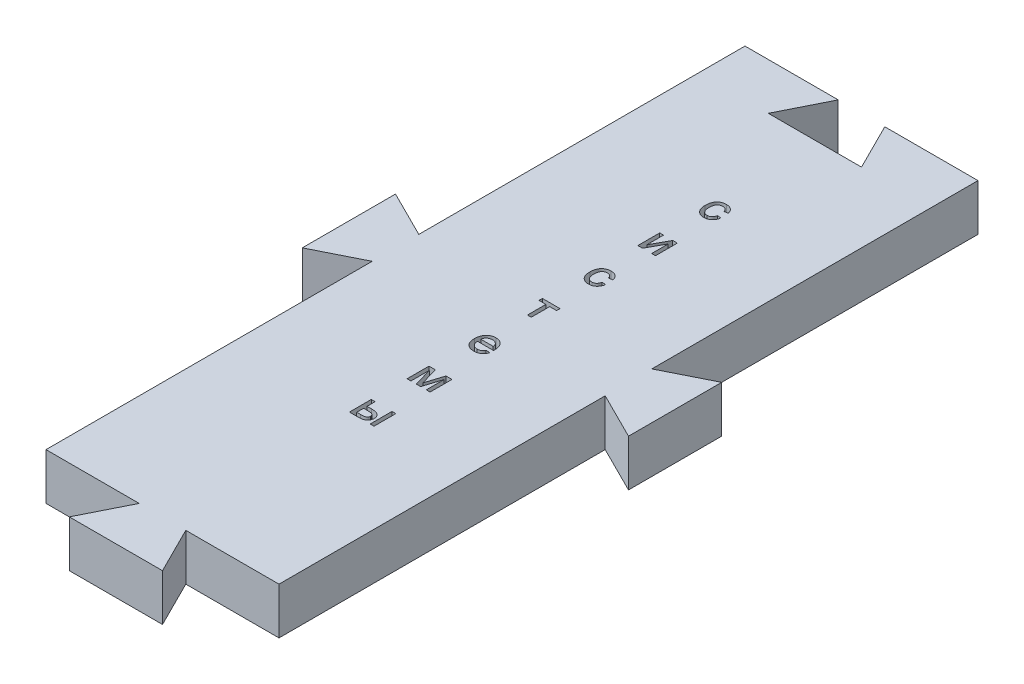
from build123d import *

# Parameters (mm, degrees)
EXTRUDE_1_DEPTH     = 4
SKETCH_2_W          = 0.329271627
SKETCH_2_H          = 1.87684827
CUT_EXTRUDE_2_DEPTH = 45.924937396


with BuildPart() as part:
    # Эскиз1 → Бобышка-Вытянуть1 (new body)
    with BuildSketch(Plane(origin=(0, 0, 0), x_dir=(1, 0, 0), z_dir=(0, 1, 0))):
        Polygon((10, 42.5), (2, 42.5), (4, 38.5), (-4, 38.5), (-2, 42.5), (-10, 42.5), (-10, 14.5), (-14, 16.5), (-14, 8.5), (-10, 10.5), (-10, -17.5), (-2, -17.5), (-4, -21.5), (4, -21.5), (2, -17.5), (10, -17.5), (10, 10.5), (14, 8.5), (14, 16.5), (10, 14.5), align=None)
    extrude(amount=EXTRUDE_1_DEPTH)

    # Эскиз2 → Вырез-Вытянуть2 (cut, through all)
    # profile 1 of 8: a face of its own
    with BuildSketch(Plane(origin=(0, 0, 0), x_dir=(1, 0, 0), z_dir=(0, 1, 0))):
        with BuildLine():
            Line((1.415867993, 28.713348785), (1.745139619, 28.680421622))
            add(Edge.make_bspline(
                [(1.745139619, 28.680421622), (1.740582778, 28.654094932), (1.731632112, 28.60238336), (1.711309306, 28.527574364), (1.686316374, 28.457155782), (1.656134219, 28.391082987), (1.62142165, 28.329466239), (1.581397849, 28.272297465), (1.536410623, 28.219612381), (1.486861536, 28.171457776), (1.433005447, 28.128792998), (1.376523853, 28.090851034), (1.316485548, 28.059592042), (1.253868642, 28.033588872), (1.18820581, 28.013567965), (1.119546334, 27.999034881), (1.047859948, 27.990953021), (0.999152606, 27.989625035), (0.974438219, 27.988951207)],
                knots=[0, 0, 0, 0, 1.126290047, 2.212288299, 3.264625211, 4.274421374, 5.27199577, 6.243132084, 7.212758999, 8.189695438, 9.152066023, 10.106906036, 11.054818061, 12.001736236, 12.962610873, 13.945632539, 14.95760209, 16, 16, 16, 16], degree=3))
            add(Edge.make_bspline(
                [(0.974438219, 27.988951207), (0.943538412, 27.989812439), (0.88290093, 27.991502511), (0.794246709, 28.00266522), (0.710328713, 28.02233905), (0.631160631, 28.049677316), (0.556420513, 28.084700432), (0.486879906, 28.128375805), (0.421375303, 28.179032096), (0.361332523, 28.237721141), (0.307080407, 28.303643158), (0.260216716, 28.376877937), (0.219755411, 28.456330223), (0.187534955, 28.542911359), (0.162348446, 28.635926492), (0.144553696, 28.735770211), (0.133647665, 28.842241661), (0.132366039, 28.915515244), (0.131708651, 28.953099688)],
                knots=[0, 0, 0, 0, 1.023197875, 2.007913629, 2.952854009, 3.872368111, 4.776711232, 5.679644676, 6.586124885, 7.513792122, 8.45395957, 9.406953999, 10.38727148, 11.400874437, 12.46026104, 13.574150989, 14.755701814, 16, 16, 16, 16], degree=3))
            add(Edge.make_bspline(
                [(0.131708651, 28.953099688), (0.131997583, 28.97780251), (0.132567942, 29.02656632), (0.137307257, 29.098497779), (0.144910749, 29.168046247), (0.155817073, 29.235165532), (0.169399327, 29.300039711), (0.187185655, 29.362227009), (0.207170271, 29.422251189), (0.230181201, 29.47971935), (0.256392956, 29.534519033), (0.286041625, 29.585868894), (0.319372948, 29.633473652), (0.355268299, 29.678035366), (0.395068638, 29.718645052), (0.437889116, 29.755839622), (0.483838439, 29.789415069), (0.549050471, 29.828937037), (0.635266323, 29.869992174), (0.744102706, 29.905814506), (0.857649884, 29.92747965), (0.934901181, 29.930252919), (0.973923732, 29.931653802)],
                knots=[0, 0, 0, 0, 1.013805669, 2.001270362, 2.957354649, 3.884259307, 4.791280502, 5.67595866, 6.537369654, 7.386966453, 8.214944774, 9.028648359, 9.817495426, 10.598008034, 11.374511297, 12.14791384, 12.923651068, 13.707109795, 15.274991334, 16.830882343, 18.399158828, 20, 20, 20, 20], degree=3))
            add(Edge.make_bspline(
                [(0.973923732, 29.931653802), (0.998465697, 29.931139599), (1.046627906, 29.930130504), (1.116958271, 29.922833743), (1.184097536, 29.911089985), (1.24760722, 29.894196305), (1.307949111, 29.872518553), (1.364564022, 29.845696306), (1.417831374, 29.81423851), (1.467415763, 29.778024836), (1.513270616, 29.737546359), (1.554404631, 29.692405319), (1.591986313, 29.643766278), (1.624577988, 29.590605721), (1.653917721, 29.53372663), (1.677577655, 29.472316994), (1.698180887, 29.407303756), (1.707472915, 29.362048176), (1.712212457, 29.338964875)],
                knots=[0, 0, 0, 0, 1.132709169, 2.22287732, 3.260172152, 4.27594812, 5.252565374, 6.215743486, 7.163376455, 8.103906971, 9.045968701, 9.981589193, 10.918916077, 11.878868217, 12.855998669, 13.868839979, 14.912969196, 16, 16, 16, 16], degree=3))
            Line((1.712212457, 29.338964875), (1.38294083, 29.306037712))
            add(Edge.make_bspline(
                [(1.38294083, 29.306037712), (1.375305492, 29.332039723), (1.3607024, 29.381770299), (1.32724784, 29.449584197), (1.28531, 29.506934959), (1.235300826, 29.553930157), (1.178376594, 29.590181305), (1.116074399, 29.616780626), (1.047760103, 29.632612436), (1.000419112, 29.63439116), (0.97598168, 29.635309339)],
                knots=[0, 0, 0, 0, 1.141726713, 2.183628378, 3.172002178, 4.124091198, 5.061356818, 6.004746239, 6.970049491, 8, 8, 8, 8], degree=3))
            add(Edge.make_bspline(
                [(0.97598168, 29.635309339), (0.957255736, 29.634860726), (0.920666759, 29.633984172), (0.867317766, 29.625793751), (0.816399262, 29.613878688), (0.768473615, 29.595448224), (0.722794164, 29.572837295), (0.679892342, 29.544962093), (0.640064158, 29.511592607), (0.602901794, 29.47354085), (0.569088151, 29.429913111), (0.539693904, 29.380411173), (0.515749064, 29.32471313), (0.495653421, 29.26359085), (0.479744283, 29.196485819), (0.468716676, 29.123355988), (0.461942018, 29.044464392), (0.461307844, 28.98998566), (0.460980277, 28.961845965)],
                knots=[0, 0, 0, 0, 0.934506579, 1.825950114, 2.690068634, 3.541100821, 4.383731181, 5.231784627, 6.089299408, 6.973555431, 7.883203127, 8.839396139, 9.840301414, 10.904673265, 12.049269491, 13.27993044, 14.595012659, 16, 16, 16, 16], degree=3))
            add(Edge.make_bspline(
                [(0.460980277, 28.961845965), (0.461284046, 28.933189236), (0.461868852, 28.878020157), (0.468876223, 28.798329892), (0.479214202, 28.724479131), (0.494793561, 28.656817596), (0.513405127, 28.594657934), (0.537738977, 28.539072406), (0.565940647, 28.489187627), (0.598657779, 28.445635557), (0.634903898, 28.407774892), (0.674276161, 28.375506783), (0.715611188, 28.347110995), (0.760131252, 28.324548603), (0.807233957, 28.30687068), (0.857003168, 28.294766162), (0.909177104, 28.286657428), (0.944909325, 28.28575538), (0.963119507, 28.285295671)],
                knots=[0, 0, 0, 0, 1.439417322, 2.771123253, 4.016540659, 5.182963063, 6.256782941, 7.271700823, 8.22505475, 9.129818122, 10.001307906, 10.851929949, 11.68361798, 12.516019905, 13.353091662, 14.205762507, 15.085604268, 16, 16, 16, 16], degree=3))
            add(Edge.make_bspline(
                [(0.963119507, 28.285295671), (0.977714164, 28.285533981), (1.006483856, 28.28600375), (1.048782225, 28.291466686), (1.089255458, 28.299477912), (1.127907023, 28.310848982), (1.164479288, 28.32595169), (1.199491674, 28.343893338), (1.232763434, 28.365022969), (1.263500211, 28.389991357), (1.292836943, 28.417583076), (1.318236174, 28.449885891), (1.341685871, 28.485047677), (1.362175776, 28.52389157), (1.380338948, 28.566137024), (1.394878811, 28.612082573), (1.407674912, 28.66129028), (1.413078485, 28.695624361), (1.415867993, 28.713348785)],
                knots=[0, 0, 0, 0, 1.014969467, 2.000756802, 2.962635172, 3.883905016, 4.799126561, 5.711777145, 6.618793064, 7.535724579, 8.464077664, 9.414562763, 10.387627853, 11.401965749, 12.465912699, 13.582944017, 14.752233276, 16, 16, 16, 16], degree=3))
        make_face()
    # profile 2 of 8: a face of its own
    with BuildSketch(Plane(origin=(0, 0, 0), x_dir=(1, 0, 0), z_dir=(0, 1, 0))):
        Polygon((0.230490138, 24.947467124), (0.559761765, 24.947467124), (0.559761765, 23.516164524), (1.34795572, 24.947467124), (1.745139619, 24.947467124), (1.745139619, 23.070618855), (1.415867993, 23.070618855), (1.415867993, 24.493175177), (0.632818907, 23.070618855), (0.230490138, 23.070618855), align=None)
    # profile 3 of 8: a face of its own
    with BuildSketch(Plane(origin=(0, 0, 0), x_dir=(1, 0, 0), z_dir=(0, 1, 0))):
        with BuildLine():
            Line((1.415867993, 18.810829755), (1.745139619, 18.777902592))
            add(Edge.make_bspline(
                [(1.745139619, 18.777902592), (1.740582778, 18.751575902), (1.731632112, 18.69986433), (1.711309306, 18.625055334), (1.686316374, 18.554636752), (1.656134219, 18.488563957), (1.62142165, 18.426947209), (1.581397849, 18.369778434), (1.536410623, 18.317093351), (1.486861536, 18.268938746), (1.433005447, 18.226273968), (1.376523853, 18.188332004), (1.316485548, 18.157073011), (1.253868642, 18.131069841), (1.18820581, 18.111048935), (1.119546334, 18.09651585), (1.047859948, 18.08843399), (0.999152606, 18.087106004), (0.974438219, 18.086432177)],
                knots=[0, 0, 0, 0, 1.126290047, 2.212288299, 3.264625211, 4.274421374, 5.27199577, 6.243132084, 7.212758999, 8.189695438, 9.152066023, 10.106906036, 11.054818061, 12.001736236, 12.962610873, 13.945632539, 14.95760209, 16, 16, 16, 16], degree=3))
            add(Edge.make_bspline(
                [(0.974438219, 18.086432177), (0.943538412, 18.087293408), (0.88290093, 18.088983481), (0.794246709, 18.10014619), (0.710328713, 18.119820019), (0.631160631, 18.147158286), (0.556420513, 18.182181401), (0.486879906, 18.225856774), (0.421375303, 18.276513066), (0.361332523, 18.335202111), (0.307080407, 18.401124127), (0.260216716, 18.474358906), (0.219755411, 18.553811193), (0.187534955, 18.640392328), (0.162348446, 18.733407462), (0.144553696, 18.83325118), (0.133647665, 18.939722631), (0.132366039, 19.012996214), (0.131708651, 19.050580657)],
                knots=[0, 0, 0, 0, 1.023197875, 2.007913629, 2.952854009, 3.872368111, 4.776711232, 5.679644676, 6.586124885, 7.513792122, 8.45395957, 9.406953999, 10.38727148, 11.400874437, 12.46026104, 13.574150989, 14.755701814, 16, 16, 16, 16], degree=3))
            add(Edge.make_bspline(
                [(0.131708651, 19.050580657), (0.131997583, 19.07528348), (0.132567942, 19.124047289), (0.137307257, 19.195978749), (0.144910749, 19.265527217), (0.155817073, 19.332646501), (0.169399327, 19.39752068), (0.187185655, 19.459707979), (0.207170271, 19.519732158), (0.230181201, 19.577200319), (0.256392956, 19.632000003), (0.286041625, 19.683349863), (0.319372948, 19.730954621), (0.355268299, 19.775516336), (0.395068638, 19.816126022), (0.437889116, 19.853320591), (0.483838439, 19.886896039), (0.549050471, 19.926418006), (0.635266323, 19.967473144), (0.744102706, 20.003295476), (0.857649884, 20.02496062), (0.934901181, 20.027733889), (0.973923732, 20.029134772)],
                knots=[0, 0, 0, 0, 1.013805669, 2.001270362, 2.957354649, 3.884259307, 4.791280502, 5.67595866, 6.537369654, 7.386966453, 8.214944774, 9.028648359, 9.817495426, 10.598008034, 11.374511297, 12.14791384, 12.923651068, 13.707109795, 15.274991334, 16.830882343, 18.399158828, 20, 20, 20, 20], degree=3))
            add(Edge.make_bspline(
                [(0.973923732, 20.029134772), (0.998465697, 20.028620568), (1.046627906, 20.027611473), (1.116958271, 20.020314713), (1.184097536, 20.008570955), (1.24760722, 19.991677274), (1.307949111, 19.969999522), (1.364564022, 19.943177276), (1.417831374, 19.911719479), (1.467415763, 19.875505806), (1.513270616, 19.835027328), (1.554404631, 19.789886289), (1.591986313, 19.741247248), (1.624577988, 19.688086691), (1.653917721, 19.6312076), (1.677577655, 19.569797963), (1.698180887, 19.504784725), (1.707472915, 19.459529146), (1.712212457, 19.436445844)],
                knots=[0, 0, 0, 0, 1.132709169, 2.22287732, 3.260172152, 4.27594812, 5.252565374, 6.215743486, 7.163376455, 8.103906971, 9.045968701, 9.981589193, 10.918916077, 11.878868217, 12.855998669, 13.868839979, 14.912969196, 16, 16, 16, 16], degree=3))
            Line((1.712212457, 19.436445844), (1.38294083, 19.403518682))
            add(Edge.make_bspline(
                [(1.38294083, 19.403518682), (1.375305492, 19.429520692), (1.3607024, 19.479251269), (1.32724784, 19.547065167), (1.28531, 19.604415928), (1.235300826, 19.651411127), (1.178376594, 19.687662275), (1.116074399, 19.714261595), (1.047760103, 19.730093405), (1.000419112, 19.73187213), (0.97598168, 19.732790308)],
                knots=[0, 0, 0, 0, 1.141726713, 2.183628378, 3.172002178, 4.124091198, 5.061356818, 6.004746239, 6.970049491, 8, 8, 8, 8], degree=3))
            add(Edge.make_bspline(
                [(0.97598168, 19.732790308), (0.957255736, 19.732341695), (0.920666759, 19.731465142), (0.867317766, 19.723274721), (0.816399262, 19.711359658), (0.768473615, 19.692929194), (0.722794164, 19.670318265), (0.679892342, 19.642443062), (0.640064158, 19.609073577), (0.602901794, 19.57102182), (0.569088151, 19.52739408), (0.539693904, 19.477892143), (0.515749064, 19.422194099), (0.495653421, 19.36107182), (0.479744283, 19.293966788), (0.468716676, 19.220836957), (0.461942018, 19.141945361), (0.461307844, 19.08746663), (0.460980277, 19.059326935)],
                knots=[0, 0, 0, 0, 0.934506579, 1.825950114, 2.690068634, 3.541100821, 4.383731181, 5.231784627, 6.089299408, 6.973555431, 7.883203127, 8.839396139, 9.840301414, 10.904673265, 12.049269491, 13.27993044, 14.595012659, 16, 16, 16, 16], degree=3))
            add(Edge.make_bspline(
                [(0.460980277, 19.059326935), (0.461284046, 19.030670206), (0.461868852, 18.975501127), (0.468876223, 18.895810861), (0.479214202, 18.8219601), (0.494793561, 18.754298566), (0.513405127, 18.692138903), (0.537738977, 18.636553375), (0.565940647, 18.586668596), (0.598657779, 18.543116527), (0.634903898, 18.505255862), (0.674276161, 18.472987753), (0.715611188, 18.444591965), (0.760131252, 18.422029573), (0.807233957, 18.40435165), (0.857003168, 18.392247131), (0.909177104, 18.384138397), (0.944909325, 18.38323635), (0.963119507, 18.38277664)],
                knots=[0, 0, 0, 0, 1.439417322, 2.771123253, 4.016540659, 5.182963063, 6.256782941, 7.271700823, 8.22505475, 9.129818122, 10.001307906, 10.851929949, 11.68361798, 12.516019905, 13.353091662, 14.205762507, 15.085604268, 16, 16, 16, 16], degree=3))
            add(Edge.make_bspline(
                [(0.963119507, 18.38277664), (0.977714164, 18.383014951), (1.006483856, 18.38348472), (1.048782225, 18.388947655), (1.089255458, 18.396958881), (1.127907023, 18.408329951), (1.164479288, 18.42343266), (1.199491674, 18.441374308), (1.232763434, 18.462503938), (1.263500211, 18.487472327), (1.292836943, 18.515064046), (1.318236174, 18.54736686), (1.341685871, 18.582528647), (1.362175776, 18.621372539), (1.380338948, 18.663617994), (1.394878811, 18.709563542), (1.407674912, 18.758771249), (1.413078485, 18.793105331), (1.415867993, 18.810829755)],
                knots=[0, 0, 0, 0, 1.014969467, 2.000756802, 2.962635172, 3.883905016, 4.799126561, 5.711777145, 6.618793064, 7.535724579, 8.464077664, 9.414562763, 10.387627853, 11.401965749, 12.465912699, 13.582944017, 14.752233276, 16, 16, 16, 16], degree=3))
        make_face()
    # profile 4 of 8: a face of its own
    with BuildSketch(Plane(origin=(0, 0, 0), x_dir=(1, 0, 0), z_dir=(0, 1, 0))):
        Polygon((0.065854325, 15.044948094), (1.580503806, 15.044948094), (1.580503806, 14.74860363), (0.987814879, 14.74860363), (0.987814879, 13.168099824), (0.658543253, 13.168099824), (0.658543253, 14.74860363), (0.065854325, 14.74860363), align=None)
    # profile 5 of 8: a face of its own
    with BuildSketch(Plane(origin=(0, 0, 0), x_dir=(1, 0, 0), z_dir=(0, 1, 0))):
        with BuildLine():
            Line((1.511048072, 8.776602074), (1.833631369, 8.743674911))
            add(Edge.make_bspline(
                [(1.833631369, 8.743674911), (1.827017133, 8.721915844), (1.814005637, 8.679111503), (1.787605242, 8.618402002), (1.758594774, 8.560725095), (1.724319497, 8.507337628), (1.686711189, 8.457103352), (1.645024697, 8.410422957), (1.598348808, 8.368474259), (1.548418476, 8.329505443), (1.494402919, 8.29525842), (1.436871535, 8.26502238), (1.375613664, 8.240068621), (1.310804138, 8.219280743), (1.242294815, 8.203425925), (1.170212797, 8.192472694), (1.094653189, 8.184712747), (1.043057359, 8.184184006), (1.016626146, 8.183913146)],
                knots=[0, 0, 0, 0, 1.017198368, 2.001028156, 2.958938375, 3.904526299, 4.836491671, 5.766019286, 6.700699831, 7.641977538, 8.598163567, 9.559604839, 10.547559217, 11.555094156, 12.60347703, 13.691418688, 14.817373327, 16, 16, 16, 16], degree=3))
            add(Edge.make_bspline(
                [(1.016626146, 8.183913146), (0.983489227, 8.184691849), (0.91888251, 8.186210077), (0.824532269, 8.198389696), (0.735410698, 8.217656496), (0.651323709, 8.244954168), (0.572810165, 8.280528034), (0.499670687, 8.324280073), (0.431450339, 8.375199465), (0.36913115, 8.434182942), (0.312747238, 8.49992092), (0.264593072, 8.573015791), (0.222829787, 8.651715788), (0.189613916, 8.737299304), (0.163359887, 8.828909447), (0.145143746, 8.926936087), (0.133489062, 9.030990305), (0.132312384, 9.102582536), (0.131708651, 9.139315349)],
                knots=[0, 0, 0, 0, 1.077616366, 2.10101772, 3.089143248, 4.040031729, 4.971276009, 5.886882173, 6.807369977, 7.734796568, 8.672701003, 9.618074947, 10.576315496, 11.565652878, 12.598619221, 13.67195277, 14.805516698, 16, 16, 16, 16], degree=3))
            add(Edge.make_bspline(
                [(0.131708651, 9.139315349), (0.132318235, 9.177416451), (0.133501863, 9.251397177), (0.145007119, 9.359112972), (0.164034435, 9.460247603), (0.189853954, 9.555167995), (0.224066525, 9.643415608), (0.265812064, 9.724958271), (0.314832447, 9.80023748), (0.371601195, 9.868150905), (0.434416199, 9.928542506), (0.501281674, 9.982243956), (0.573600942, 10.026561979), (0.649895749, 10.063357856), (0.73090143, 10.091628146), (0.816118979, 10.112447824), (0.906197264, 10.124195797), (0.967716815, 10.125797688), (0.999133591, 10.126615741)],
                knots=[0, 0, 0, 0, 1.232307979, 2.392766439, 3.499416159, 4.558769794, 5.570548426, 6.555643267, 7.517416609, 8.470735273, 9.412423306, 10.33263532, 11.239503873, 12.150233765, 13.067967044, 14.009932887, 14.983713455, 16, 16, 16, 16], degree=3))
            add(Edge.make_bspline(
                [(0.999133591, 10.126615741), (1.029530515, 10.12583408), (1.089018183, 10.124304345), (1.176169626, 10.112026543), (1.259214413, 10.092840407), (1.337978193, 10.064973593), (1.412064553, 10.028393757), (1.48227363, 9.98473488), (1.548114968, 9.932733397), (1.609166296, 9.873097869), (1.664793143, 9.806497863), (1.712911201, 9.732675093), (1.753655226, 9.65266762), (1.786684355, 9.565863777), (1.812108966, 9.472763887), (1.830528421, 9.373306998), (1.8421446, 9.267526924), (1.843317936, 9.194739736), (1.843921107, 9.157322391)],
                knots=[0, 0, 0, 0, 1.005323219, 1.967446859, 2.906060863, 3.821317632, 4.724696067, 5.63467896, 6.55185077, 7.494776645, 8.453732942, 9.416859909, 10.403972786, 11.418730779, 12.484189468, 13.592581733, 14.76243057, 16, 16, 16, 16], degree=3))
            add(Edge.make_bspline(
                [(1.843921107, 9.157322391), (1.843764419, 9.145660425), (1.843386501, 9.117532713), (1.842750157, 9.089409594), (1.842377646, 9.072946537)],
                knots=[0, 0, 0, 0, 0.829215456, 2, 2, 2, 2], degree=3))
            Line((1.842377646, 9.072946537), (0.460980277, 9.072946537))
            add(Edge.make_bspline(
                [(0.460980277, 9.072946537), (0.462886508, 9.049757327), (0.466615859, 9.004389961), (0.47749119, 8.938706384), (0.492167711, 8.876977289), (0.51192404, 8.819746206), (0.535262842, 8.766372164), (0.564105674, 8.717733086), (0.596239041, 8.672748687), (0.633159479, 8.632515716), (0.673003793, 8.596728819), (0.715641989, 8.565335648), (0.760998452, 8.539297496), (0.808417026, 8.517407789), (0.85834083, 8.500935758), (0.910542027, 8.489147885), (0.965311956, 8.481773025), (1.00271164, 8.480769182), (1.021771015, 8.48025761)],
                knots=[0, 0, 0, 0, 1.224729154, 2.396059788, 3.502114335, 4.561587772, 5.580251543, 6.563724943, 7.533714888, 8.486186356, 9.43260269, 10.350144711, 11.268619442, 12.181885516, 13.095687177, 14.031096784, 14.996620783, 16, 16, 16, 16], degree=3))
            add(Edge.make_bspline(
                [(1.021771015, 8.48025761), (1.049599056, 8.481189338), (1.103509002, 8.482994331), (1.18129617, 8.495657655), (1.252600337, 8.517985636), (1.317922596, 8.548979797), (1.377154551, 8.590065073), (1.428839403, 8.642653468), (1.474791068, 8.704980154), (1.498691169, 8.752192303), (1.511048072, 8.776602074)],
                knots=[0, 0, 0, 0, 1.096312125, 2.123833578, 3.094060441, 4.030938787, 4.962563683, 5.918139224, 6.923629937, 8, 8, 8, 8], degree=3))
        make_face()
        with BuildLine():
            Line((0.460980277, 9.369291001), (1.514649481, 9.369291001))
            add(Edge.make_bspline(
                [(1.514649481, 9.369291001), (1.512576801, 9.385605281), (1.508524259, 9.417503267), (1.499994309, 9.463639718), (1.488618068, 9.506624693), (1.47491713, 9.546296739), (1.458209766, 9.582731806), (1.439333166, 9.615985799), (1.418240935, 9.646413848), (1.401848026, 9.664097366), (1.393745056, 9.672838281)],
                knots=[0, 0, 0, 0, 1.185316253, 2.317552585, 3.379013743, 4.387694847, 5.339152611, 6.263729899, 7.141766409, 8, 8, 8, 8], degree=3))
            add(Edge.make_bspline(
                [(1.393745056, 9.672838281), (1.380798356, 9.685474672), (1.355226411, 9.710433704), (1.312591058, 9.742607493), (1.266770645, 9.769288829), (1.218655975, 9.792309916), (1.167170855, 9.808988091), (1.113346089, 9.821587484), (1.056432424, 9.828724823), (1.017502661, 9.82974795), (0.99759013, 9.830271278)],
                knots=[0, 0, 0, 0, 0.989486767, 1.954405495, 2.91383024, 3.888017634, 4.867526279, 5.869356945, 6.910178459, 8, 8, 8, 8], degree=3))
            add(Edge.make_bspline(
                [(0.99759013, 9.830271278), (0.979567853, 9.829852762), (0.944290487, 9.829033547), (0.892319165, 9.823268735), (0.842507964, 9.813712156), (0.794945183, 9.799532939), (0.749457091, 9.782299781), (0.706363527, 9.760270485), (0.665362846, 9.734673209), (0.626618351, 9.705393405), (0.59156885, 9.672579992), (0.559515625, 9.637626406), (0.532978766, 9.598994677), (0.509449834, 9.558484791), (0.49102652, 9.514832489), (0.476522876, 9.468680824), (0.466198545, 9.419902604), (0.462735198, 9.386311856), (0.460980277, 9.369291001)],
                knots=[0, 0, 0, 0, 1.10270868, 2.158476208, 3.195774995, 4.201977093, 5.192014471, 6.168217026, 7.158254405, 8.146844603, 9.134487423, 10.093158795, 11.042305272, 11.996428104, 12.955501471, 13.934632866, 14.95345241, 16, 16, 16, 16], degree=3))
        make_face(mode=Mode.SUBTRACT)
    # profile 6 of 8: a face of its own
    with BuildSketch(Plane(origin=(0, 0, 0), x_dir=(1, 0, 0), z_dir=(0, 1, 0))):
        Polygon((0.230490138, 5.142429063), (0.769157939, 5.142429063), (1.213160148, 3.640127269), (1.694205415, 5.142429063), (2.206119896, 5.142429063), (2.206119896, 3.265580794), (1.87684827, 3.265580794), (1.87684827, 4.776628866), (1.393230569, 3.265580794), (1.022799989, 3.265580794), (0.559761765, 4.849171521), (0.559761765, 3.265580794), (0.230490138, 3.265580794), align=None)
    # profile 7 of 8: a face of its own
    with BuildSketch(Plane(origin=(0, 0, 0), x_dir=(1, 0, 0), z_dir=(0, 1, 0))):
        with Locations((2.173192734, -0.747254587)):
            Rectangle(SKETCH_2_W, SKETCH_2_H)
    # profile 8 of 8: a face of its own
    with BuildSketch(Plane(origin=(0, 0, 0), x_dir=(1, 0, 0), z_dir=(0, 1, 0))):
        with BuildLine():
            Line((0.230490138, 0.191169548), (0.559761765, 0.191169548))
            Line((0.559761765, 0.191169548), (0.559761765, -0.500300867))
            Line((0.559761765, -0.500300867), (0.961061559, -0.500300867))
            add(Edge.make_bspline(
                [(0.961061559, -0.500300867), (0.99280148, -0.500818356), (1.05465058, -0.501826748), (1.144536794, -0.508938186), (1.228816806, -0.521085034), (1.3073265, -0.538757692), (1.380511047, -0.560416656), (1.447987477, -0.587957416), (1.509789393, -0.620168603), (1.56581537, -0.657468532), (1.615709265, -0.699007646), (1.659322522, -0.74449709), (1.696171324, -0.79371248), (1.726380634, -0.846713687), (1.749599778, -0.903657274), (1.765805551, -0.96435104), (1.776718642, -1.028630021), (1.777609871, -1.072877597), (1.778066782, -1.095562229)],
                knots=[0, 0, 0, 0, 1.335577774, 2.60253589, 3.791541265, 4.915587806, 5.986314209, 6.999458239, 7.977554621, 8.914281693, 9.826274375, 10.704224314, 11.56012663, 12.406913906, 13.26460939, 14.139975064, 15.046411478, 16, 16, 16, 16], degree=3))
            add(Edge.make_bspline(
                [(1.778066782, -1.095562229), (1.777682885, -1.115493346), (1.77692443, -1.15487066), (1.76756108, -1.212703529), (1.753890014, -1.268620276), (1.734324561, -1.322337108), (1.708704916, -1.373474167), (1.678333872, -1.422911429), (1.641529928, -1.469462932), (1.599859516, -1.514076528), (1.552074878, -1.555108333), (1.496775632, -1.59004518), (1.435238624, -1.620073876), (1.36675506, -1.643947517), (1.291746681, -1.663145214), (1.209909696, -1.675928103), (1.121592696, -1.684506471), (1.060551358, -1.685279054), (1.028973832, -1.685678722)],
                knots=[0, 0, 0, 0, 0.887026553, 1.752471933, 2.602951318, 3.448854779, 4.292754953, 5.147102897, 6.028882972, 6.931433669, 7.863663326, 8.825778708, 9.837135929, 10.907592124, 12.050842633, 13.281686072, 14.593778685, 16, 16, 16, 16], degree=3))
            Line((1.028973832, -1.685678722), (0.230490138, -1.685678722))
            Line((0.230490138, -1.685678722), (0.230490138, 0.191169548))
        make_face()
        with BuildLine():
            Line((0.559761765, -1.389334258), (0.891605826, -1.389334258))
            add(Edge.make_bspline(
                [(0.891605826, -1.389334258), (0.915795182, -1.389231632), (0.962316845, -1.38903426), (1.029358727, -1.384897797), (1.091120543, -1.38060332), (1.147300651, -1.371798028), (1.198491611, -1.362572747), (1.24420923, -1.350205798), (1.284608109, -1.33602825), (1.319784125, -1.319297645), (1.35045714, -1.300464096), (1.376360846, -1.278383803), (1.399045458, -1.254521851), (1.417538428, -1.227858498), (1.431687405, -1.19848114), (1.441268578, -1.166689988), (1.447747371, -1.132522872), (1.448439169, -1.108799067), (1.448795156, -1.096591203)],
                knots=[0, 0, 0, 0, 1.638146504, 3.15053018, 4.549389185, 5.829199533, 7.000260584, 8.07109606, 9.033827345, 9.896376666, 10.705399559, 11.463974583, 12.195469878, 12.930186622, 13.652398606, 14.394607991, 15.173892779, 16, 16, 16, 16], degree=3))
            add(Edge.make_bspline(
                [(1.448795156, -1.096591203), (1.447560544, -1.077423845), (1.445115982, -1.039471995), (1.426740098, -0.984310425), (1.395791257, -0.933357812), (1.361478702, -0.893648543), (1.325829339, -0.864782008), (1.290606797, -0.846483268), (1.248388022, -0.831517803), (1.199509574, -0.817839468), (1.143062517, -0.808751898), (1.07973221, -0.801430109), (1.009126089, -0.79759281), (0.95969316, -0.796971076), (0.933793753, -0.796645331)],
                knots=[0, 0, 0, 0, 1.023678172, 2.026908507, 3.071036652, 4.194928554, 4.814965976, 5.512345165, 6.304328096, 7.207406702, 8.221886701, 9.356943365, 10.615222673, 12, 12, 12, 12], degree=3))
            Line((0.933793753, -0.796645331), (0.559761765, -0.796645331))
            Line((0.559761765, -0.796645331), (0.559761765, -1.389334258))
        make_face(mode=Mode.SUBTRACT)
    extrude(amount=CUT_EXTRUDE_2_DEPTH, mode=Mode.SUBTRACT)


with BuildPart() as cut_extrude_2_piece_1:
    # of the separate pieces the step leaves, piece 1, a body of its own (cut_extrude_2_pieces)
    add(part.part.solids().sort_by_distance((10, 0, -42.5))[0])


with BuildPart() as cut_extrude_2_piece_2:
    # of the separate pieces the step leaves, piece 2, a body of its own (cut_extrude_2_pieces)
    add(part.part.solids().sort_by_distance((0.559761765, 0, 0.796645331))[0])


with BuildPart() as cut_extrude_2_piece_3:
    # of the separate pieces the step leaves, piece 3, a body of its own (cut_extrude_2_pieces)
    add(part.part.solids().sort_by_distance((0.99759013, 0, -9.830271278))[0])


solid = Compound([cut_extrude_2_piece_1.part, cut_extrude_2_piece_2.part, cut_extrude_2_piece_3.part])
